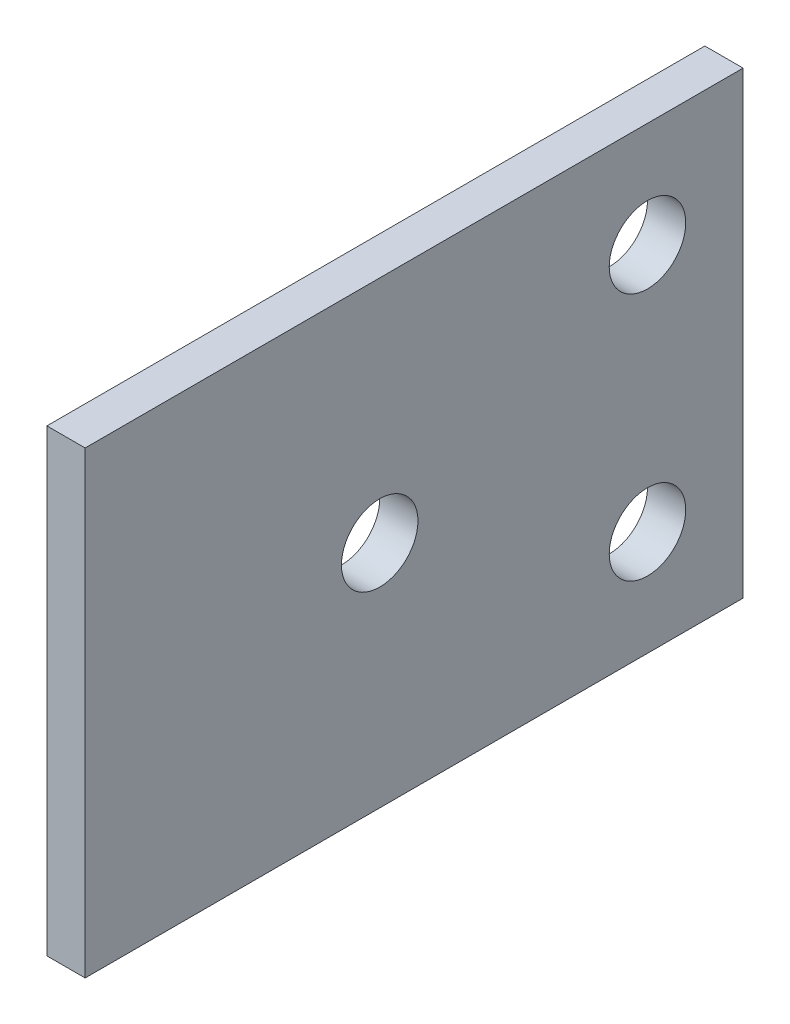
from build123d import *

# Parameters (mm, degrees)
SKETCH1_W               = 172
SKETCH1_H               = 120
BOSS_EXTRUDE1_DEPTH     = 10
CUT_EXTRUDE1_DEPTH      = 106.337552658
CUT_EXTRUDE1_DEPTH_BACK = 106.337552658
SKETCH2_R               = 10


with BuildPart() as part:
    # Sketch1 → Boss-Extrude1 (new body)
    with BuildSketch(Plane(origin=(0, 0, 0), x_dir=(0, 0, -1), z_dir=(1, 0, 0))):
        Rectangle(SKETCH1_W, SKETCH1_H)
    extrude(amount=BOSS_EXTRUDE1_DEPTH)

    # Sketch2 → Cut-Extrude1 (cut, two sides: drawn at the far end of the back side and taken through both)
    with BuildSketch(Plane(origin=(10, 0, 0), x_dir=(0, 0, -1), z_dir=(1, 0, 0)).offset(-CUT_EXTRUDE1_DEPTH_BACK)):
        with Locations((-9, 0)):
            Circle(SKETCH2_R)
        with Locations((61, 32.5)):
            Circle(SKETCH2_R)
        with Locations((61, -32.5)):
            Circle(SKETCH2_R)
    extrude(amount=CUT_EXTRUDE1_DEPTH + CUT_EXTRUDE1_DEPTH_BACK, mode=Mode.SUBTRACT)


solid = part.part
